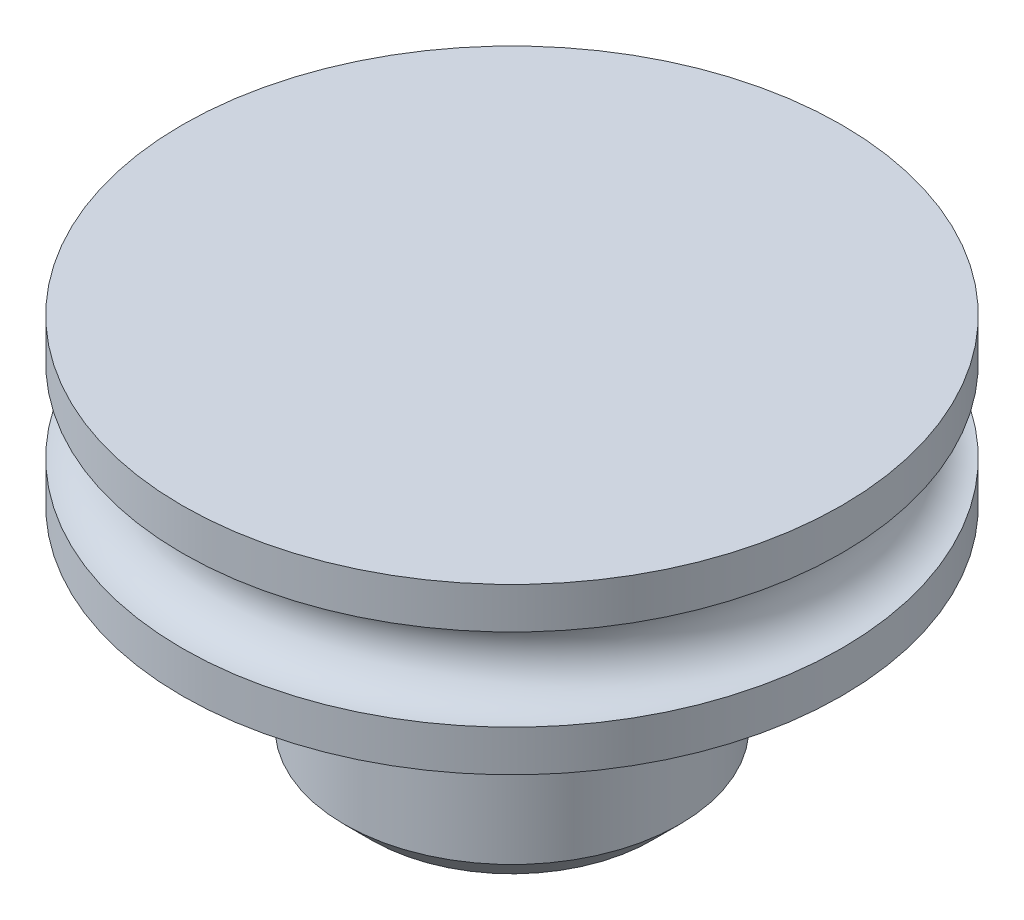
from build123d import *

# Parameters (mm, degrees)
SKETCH1_R           = 3.05
BOSS_EXTRUDE1_DEPTH = 3
SKETCH4_R           = 3.6
BOSS_EXTRUDE3_DEPTH = 1
SKETCH2_R           = 6
BOSS_EXTRUDE2_DEPTH = 3
SKETCH3_R           = 0.75
CHAMFER1_SIZE       = 0.5


with BuildPart() as part:
    # Sketch1 → Boss-Extrude1 (new body)
    with BuildSketch(Plane(origin=(0, 0, 0), x_dir=(1, 0, 0), z_dir=(0, 1, 0))):
        with Locations(Location((0, 0, 0), (0, 0, 270))):
            Circle(SKETCH1_R)
    extrude(amount=BOSS_EXTRUDE1_DEPTH)

    # Sketch4 → Boss-Extrude3 (add)
    with BuildSketch(Plane(origin=(0, 3, 0), x_dir=(1, 0, 0), z_dir=(0, 1, 0))):
        with Locations(Location((0, 0, 0), (0, 0, 270))):
            Circle(SKETCH4_R)
    extrude(amount=BOSS_EXTRUDE3_DEPTH)

    # Sketch2 → Boss-Extrude2 (add)
    with BuildSketch(Plane(origin=(0, 4, 0), x_dir=(1, 0, 0), z_dir=(0, 1, 0))):
        with Locations(Location((0, 0, 0), (0, 0, 270))):
            Circle(SKETCH2_R)
    extrude(amount=BOSS_EXTRUDE2_DEPTH)

    # Sketch3 → Cut-Revolve1 (revolve, cut)
    with BuildSketch(Plane.XY, mode=Mode.PRIVATE) as cut_revolve1_sk:
        with Locations((-6, 5.5)):
            Circle(SKETCH3_R)
    revolve(cut_revolve1_sk.sketch.rotate(Axis((0, 9.115200414, 0), (0, -1, 0)), 270), axis=Axis((0, 9.115200414, 0), (0, -1, 0)), mode=Mode.SUBTRACT)

    # Chamfer1
    chamfer1_edges = [part.edges().sort_by_distance(p)[0] for p in [
        (0, 0, -3.05),
    ]]
    chamfer(chamfer1_edges, length=CHAMFER1_SIZE)


solid = part.part
